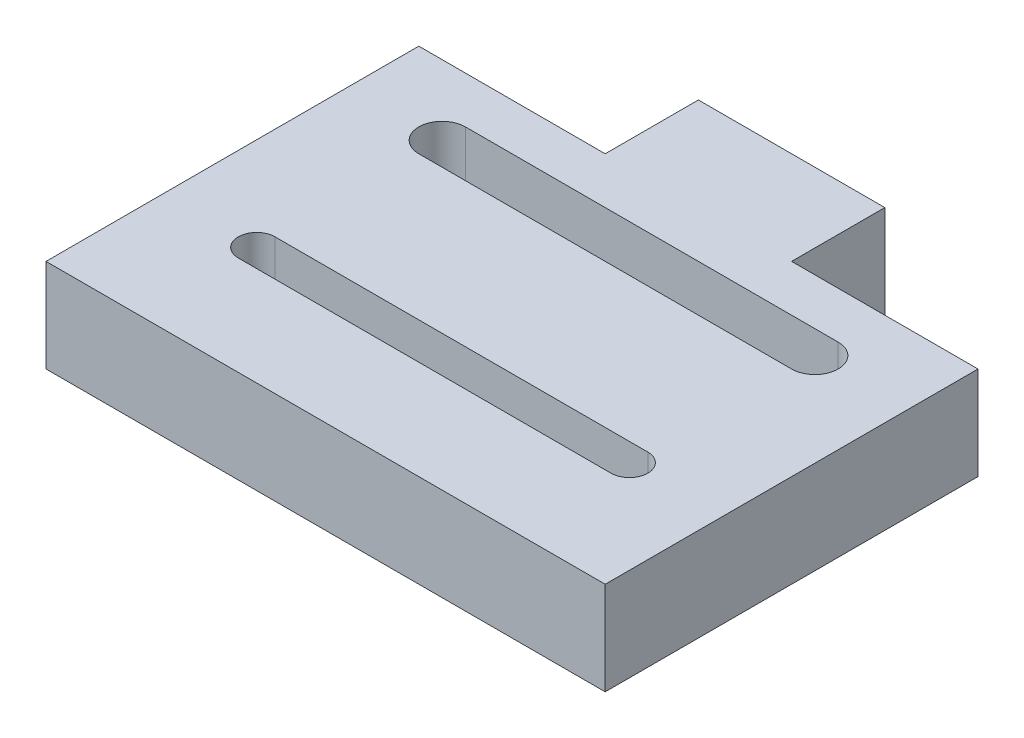
from build123d import *

# Parameters (mm, degrees)
SKETCH1_W           = 38.1
SKETCH1_H           = 6.35
BOSS_EXTRUDE1_DEPTH = 25.4
SKETCH2_W           = 25.4
SKETCH2_H           = 2.5
CUT_EXTRUDE1_DEPTH  = 33.378773911
SKETCH3_W           = 12.7
SKETCH3_H           = 6.35
BOSS_EXTRUDE4_DEPTH = 6.35
SKETCH4_W           = 12.7
SKETCH4_H           = 3.175
CUT_EXTRUDE2_DEPTH  = 10


with BuildPart() as part:
    # Sketch1 → Boss-Extrude1 (new body)
    with BuildSketch(Plane.XY):
        with Locations((0, -9.523336827)):
            Rectangle(SKETCH1_W, SKETCH1_H)
    extrude(amount=BOSS_EXTRUDE1_DEPTH)

    # Sketch2 → Cut-Extrude1 (cut, through all)
    with BuildSketch(Plane(origin=(0, -6.348336827, 0), x_dir=(1, 0, 0), z_dir=(0, 1, 0))):
        with Locations((0, -17.399)):
            Rectangle(SKETCH2_W, SKETCH2_H)
        with BuildLine():
            Line((12.7, -18.649), (12.7, -16.149))
            ThreePointArc((12.7, -16.149), (13.95, -17.399), (12.7, -18.649))
        make_face()
        with BuildLine():
            ThreePointArc((-12.7, -18.649), (-13.95, -17.399), (-12.7, -16.149))
            Line((-12.7, -16.149), (-12.7, -18.649))
        make_face()
    extrude(amount=-CUT_EXTRUDE1_DEPTH, mode=Mode.SUBTRACT)

    # Sketch3 → Boss-Extrude4 (add)
    with BuildSketch(Plane(origin=(0, 0, 0), x_dir=(-1, 0, 0), z_dir=(0, 0, -1))):
        with Locations((0, -9.523336827)):
            Rectangle(SKETCH3_W, SKETCH3_H)
    extrude(amount=BOSS_EXTRUDE4_DEPTH)

    # Sketch4 → Cut-Extrude2 (cut)
    with BuildSketch(Plane(origin=(0, -6.348336827, 0), x_dir=(1, 0, 0), z_dir=(0, 1, 0))):
        with Locations((-6.35, -4.7625)):
            Rectangle(SKETCH4_W, SKETCH4_H)
        with BuildLine():
            ThreePointArc((-12.7, -6.35), (-14.2875, -4.7625), (-12.7, -3.175))
            Line((-12.7, -3.175), (-12.7, -6.35))
        make_face()
        with Locations((6.35, -4.7625)):
            Rectangle(SKETCH4_W, SKETCH4_H)
        with BuildLine():
            Line((12.7, -6.35), (12.7, -3.175))
            ThreePointArc((12.7, -3.175), (14.2875, -4.7625), (12.7, -6.35))
        make_face()
    extrude(amount=-CUT_EXTRUDE2_DEPTH, mode=Mode.SUBTRACT)


solid = part.part
